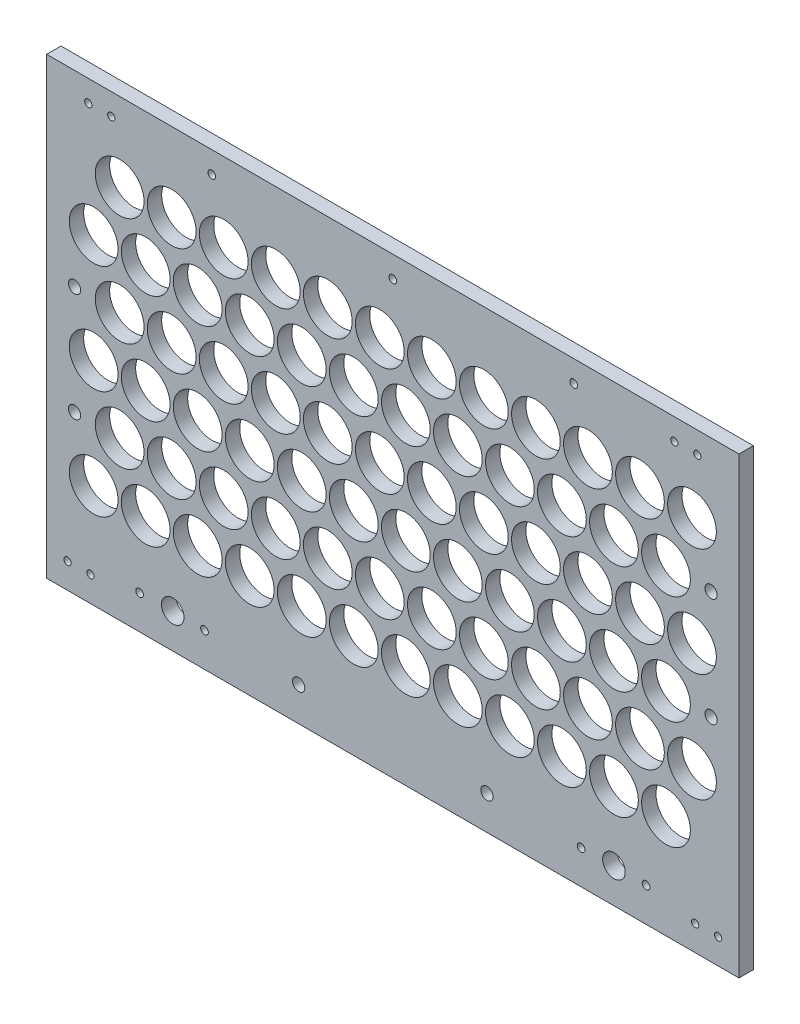
from build123d import *

# Parameters (mm, degrees)
SKETCH1_W                  = 306.05000007
SKETCH1_H                  = 197.4250001
BOSS_EXTRUDE1_DEPTH        = 6.35
SKETCH3_R                  = 10.775
CUT_EXTRUDE1_DEPTH         = 187.132543615
SKETCH4_R                  = 10.775
CUT_EXTRUDE2_DEPTH         = 187.132543615
LPATTERN1_COUNT            = 12
LPATTERN1_PITCH            = 23
LPATTERN2_COUNT            = 3
LPATTERN2_PITCH            = 48
LPATTERN2_COPY_1_SKETCH_R  = 10.775
LPATTERN2_COPY_1_DEPTH     = 187.132543615
LPATTERN2_COPY_2_SKETCH_R  = 10.775
LPATTERN2_COPY_2_DEPTH     = 187.132543615
LPATTERN2_COPY_3_SKETCH_R  = 10.775
LPATTERN2_COPY_3_DEPTH     = 187.132543615
LPATTERN2_COPY_4_SKETCH_R  = 10.775
LPATTERN2_COPY_4_DEPTH     = 187.132543615
LPATTERN2_COPY_5_SKETCH_R  = 10.775
LPATTERN2_COPY_5_DEPTH     = 187.132543615
LPATTERN2_COPY_6_SKETCH_R  = 10.775
LPATTERN2_COPY_6_DEPTH     = 187.132543615
LPATTERN2_COPY_7_SKETCH_R  = 10.775
LPATTERN2_COPY_7_DEPTH     = 187.132543615
LPATTERN2_COPY_8_SKETCH_R  = 10.775
LPATTERN2_COPY_8_DEPTH     = 187.132543615
LPATTERN2_COPY_9_SKETCH_R  = 10.775
LPATTERN2_COPY_9_DEPTH     = 187.132543615
LPATTERN2_COPY_10_SKETCH_R = 10.775
LPATTERN2_COPY_10_DEPTH    = 187.132543615
LPATTERN2_COPY_11_SKETCH_R = 10.775
LPATTERN2_COPY_11_DEPTH    = 187.132543615
LPATTERN2_COPY_12_SKETCH_R = 10.775
LPATTERN2_COPY_12_DEPTH    = 187.132543615
LPATTERN2_COPY_13_SKETCH_R = 10.775
LPATTERN2_COPY_13_DEPTH    = 187.132543615
LPATTERN2_COPY_14_SKETCH_R = 10.775
LPATTERN2_COPY_14_DEPTH    = 187.132543615
LPATTERN2_COPY_15_SKETCH_R = 10.775
LPATTERN2_COPY_15_DEPTH    = 187.132543615
LPATTERN2_COPY_16_SKETCH_R = 10.775
LPATTERN2_COPY_16_DEPTH    = 187.132543615
LPATTERN2_COPY_17_SKETCH_R = 10.775
LPATTERN2_COPY_17_DEPTH    = 187.132543615
LPATTERN2_COPY_18_SKETCH_R = 10.775
LPATTERN2_COPY_18_DEPTH    = 187.132543615
LPATTERN2_COPY_19_SKETCH_R = 10.775
LPATTERN2_COPY_19_DEPTH    = 187.132543615
LPATTERN2_COPY_20_SKETCH_R = 10.775
LPATTERN2_COPY_20_DEPTH    = 187.132543615
LPATTERN2_COPY_21_SKETCH_R = 10.775
LPATTERN2_COPY_21_DEPTH    = 187.132543615
LPATTERN2_COPY_22_SKETCH_R = 10.775
LPATTERN2_COPY_22_DEPTH    = 187.132543615
LPATTERN2_COPY_23_SKETCH_R = 10.775
LPATTERN2_COPY_23_DEPTH    = 187.132543615
LPATTERN2_COPY_24_SKETCH_R = 10.775
LPATTERN2_COPY_24_DEPTH    = 187.132543615
LPATTERN2_COPY_25_SKETCH_R = 10.775
LPATTERN2_COPY_25_DEPTH    = 187.132543615
LPATTERN2_COPY_26_SKETCH_R = 10.775
LPATTERN2_COPY_26_DEPTH    = 187.132543615
LPATTERN2_COPY_27_SKETCH_R = 10.775
LPATTERN2_COPY_27_DEPTH    = 187.132543615
LPATTERN2_COPY_28_SKETCH_R = 10.775
LPATTERN2_COPY_28_DEPTH    = 187.132543615
LPATTERN2_COPY_29_SKETCH_R = 10.775
LPATTERN2_COPY_29_DEPTH    = 187.132543615
LPATTERN2_COPY_30_SKETCH_R = 10.775
LPATTERN2_COPY_30_DEPTH    = 187.132543615
LPATTERN2_COPY_31_SKETCH_R = 10.775
LPATTERN2_COPY_31_DEPTH    = 187.132543615
LPATTERN2_COPY_32_SKETCH_R = 10.775
LPATTERN2_COPY_32_DEPTH    = 187.132543615
LPATTERN2_COPY_33_SKETCH_R = 10.775
LPATTERN2_COPY_33_DEPTH    = 187.132543615
LPATTERN2_COPY_34_SKETCH_R = 10.775
LPATTERN2_COPY_34_DEPTH    = 187.132543615
LPATTERN2_COPY_35_SKETCH_R = 10.775
LPATTERN2_COPY_35_DEPTH    = 187.132543615
LPATTERN2_COPY_36_SKETCH_R = 10.775
LPATTERN2_COPY_36_DEPTH    = 187.132543615
LPATTERN2_COPY_37_SKETCH_R = 10.775
LPATTERN2_COPY_37_DEPTH    = 187.132543615
LPATTERN2_COPY_38_SKETCH_R = 10.775
LPATTERN2_COPY_38_DEPTH    = 187.132543615
LPATTERN2_COPY_39_SKETCH_R = 10.775
LPATTERN2_COPY_39_DEPTH    = 187.132543615
LPATTERN2_COPY_40_SKETCH_R = 10.775
LPATTERN2_COPY_40_DEPTH    = 187.132543615
LPATTERN2_COPY_41_SKETCH_R = 10.775
LPATTERN2_COPY_41_DEPTH    = 187.132543615
LPATTERN2_COPY_42_SKETCH_R = 10.775
LPATTERN2_COPY_42_DEPTH    = 187.132543615
LPATTERN2_COPY_43_SKETCH_R = 10.775
LPATTERN2_COPY_43_DEPTH    = 187.132543615
LPATTERN2_COPY_44_SKETCH_R = 10.775
LPATTERN2_COPY_44_DEPTH    = 187.132543615
SKETCH5_R                  = 5
CUT_EXTRUDE3_DEPTH         = 187.132543615
M3_CLEARANCE_HOLE1_D       = 3.4
M3_CLEARANCE_HOLE2_D       = 3.2
SKETCH12_R                 = 2.7
CUT_EXTRUDE4_DEPTH         = 187.132543615
SKETCH13_W                 = 306.05000007
SKETCH13_H                 = 6.35
BOSS_EXTRUDE2_DEPTH        = 3.175


with BuildPart() as part:
    # Sketch1 → Boss-Extrude1 (new body)
    with BuildSketch(Plane.XY):
        with Locations((3.5e-08, -7.06250005)):
            Rectangle(SKETCH1_W, SKETCH1_H)
    extrude(amount=BOSS_EXTRUDE1_DEPTH)

    # Sketch3 → Cut-Extrude1 (cut, through all)
    with BuildSketch(Plane.XY.offset(6.35)):
        with Locations((-132.25, -60)):
            Circle(SKETCH3_R)
    cut_extrude1 = extrude(amount=-CUT_EXTRUDE1_DEPTH, mode=Mode.SUBTRACT)

    # Sketch4 → Cut-Extrude2 (cut, through all)
    with BuildSketch(Plane.XY.offset(6.35)):
        with Locations((-120.75, -36)):
            Circle(SKETCH4_R)
    cut_extrude2 = extrude(amount=-CUT_EXTRUDE2_DEPTH, mode=Mode.SUBTRACT)

    # LPattern1: Cut-Extrude1, Cut-Extrude2 ×12
    with Locations(*[(i * LPATTERN1_PITCH, 0, 0) for i in range(1, LPATTERN1_COUNT)]):
        add(cut_extrude1, mode=Mode.SUBTRACT)
        add(cut_extrude2, mode=Mode.SUBTRACT)

    # LPattern2: Cut-Extrude1, Cut-Extrude2 ×3
    with Locations(*[(0, i * LPATTERN2_PITCH, 0) for i in range(1, LPATTERN2_COUNT)]):
        add(cut_extrude1, mode=Mode.SUBTRACT)
        add(cut_extrude2, mode=Mode.SUBTRACT)

    # LPattern2 copy 1 sketch → LPattern2 copy 1 (cut, through all)
    with BuildSketch(Plane(origin=(23, 48, 6.35), x_dir=(1, 0, 0), z_dir=(0, 0, 1))):
        with Locations((-132.25, -60)):
            Circle(LPATTERN2_COPY_1_SKETCH_R)
    extrude(amount=-LPATTERN2_COPY_1_DEPTH, mode=Mode.SUBTRACT)

    # LPattern2 copy 2 sketch → LPattern2 copy 2 (cut, through all)
    with BuildSketch(Plane(origin=(23, 96, 6.35), x_dir=(1, 0, 0), z_dir=(0, 0, 1))):
        with Locations((-132.25, -60)):
            Circle(LPATTERN2_COPY_2_SKETCH_R)
    extrude(amount=-LPATTERN2_COPY_2_DEPTH, mode=Mode.SUBTRACT)

    # LPattern2 copy 3 sketch → LPattern2 copy 3 (cut, through all)
    with BuildSketch(Plane(origin=(46, 48, 6.35), x_dir=(1, 0, 0), z_dir=(0, 0, 1))):
        with Locations((-132.25, -60)):
            Circle(LPATTERN2_COPY_3_SKETCH_R)
    extrude(amount=-LPATTERN2_COPY_3_DEPTH, mode=Mode.SUBTRACT)

    # LPattern2 copy 4 sketch → LPattern2 copy 4 (cut, through all)
    with BuildSketch(Plane(origin=(46, 96, 6.35), x_dir=(1, 0, 0), z_dir=(0, 0, 1))):
        with Locations((-132.25, -60)):
            Circle(LPATTERN2_COPY_4_SKETCH_R)
    extrude(amount=-LPATTERN2_COPY_4_DEPTH, mode=Mode.SUBTRACT)

    # LPattern2 copy 5 sketch → LPattern2 copy 5 (cut, through all)
    with BuildSketch(Plane(origin=(69, 48, 6.35), x_dir=(1, 0, 0), z_dir=(0, 0, 1))):
        with Locations((-132.25, -60)):
            Circle(LPATTERN2_COPY_5_SKETCH_R)
    extrude(amount=-LPATTERN2_COPY_5_DEPTH, mode=Mode.SUBTRACT)

    # LPattern2 copy 6 sketch → LPattern2 copy 6 (cut, through all)
    with BuildSketch(Plane(origin=(69, 96, 6.35), x_dir=(1, 0, 0), z_dir=(0, 0, 1))):
        with Locations((-132.25, -60)):
            Circle(LPATTERN2_COPY_6_SKETCH_R)
    extrude(amount=-LPATTERN2_COPY_6_DEPTH, mode=Mode.SUBTRACT)

    # LPattern2 copy 7 sketch → LPattern2 copy 7 (cut, through all)
    with BuildSketch(Plane(origin=(92, 48, 6.35), x_dir=(1, 0, 0), z_dir=(0, 0, 1))):
        with Locations((-132.25, -60)):
            Circle(LPATTERN2_COPY_7_SKETCH_R)
    extrude(amount=-LPATTERN2_COPY_7_DEPTH, mode=Mode.SUBTRACT)

    # LPattern2 copy 8 sketch → LPattern2 copy 8 (cut, through all)
    with BuildSketch(Plane(origin=(92, 96, 6.35), x_dir=(1, 0, 0), z_dir=(0, 0, 1))):
        with Locations((-132.25, -60)):
            Circle(LPATTERN2_COPY_8_SKETCH_R)
    extrude(amount=-LPATTERN2_COPY_8_DEPTH, mode=Mode.SUBTRACT)

    # LPattern2 copy 9 sketch → LPattern2 copy 9 (cut, through all)
    with BuildSketch(Plane(origin=(115, 48, 6.35), x_dir=(1, 0, 0), z_dir=(0, 0, 1))):
        with Locations((-132.25, -60)):
            Circle(LPATTERN2_COPY_9_SKETCH_R)
    extrude(amount=-LPATTERN2_COPY_9_DEPTH, mode=Mode.SUBTRACT)

    # LPattern2 copy 10 sketch → LPattern2 copy 10 (cut, through all)
    with BuildSketch(Plane(origin=(115, 96, 6.35), x_dir=(1, 0, 0), z_dir=(0, 0, 1))):
        with Locations((-132.25, -60)):
            Circle(LPATTERN2_COPY_10_SKETCH_R)
    extrude(amount=-LPATTERN2_COPY_10_DEPTH, mode=Mode.SUBTRACT)

    # LPattern2 copy 11 sketch → LPattern2 copy 11 (cut, through all)
    with BuildSketch(Plane(origin=(138, 48, 6.35), x_dir=(1, 0, 0), z_dir=(0, 0, 1))):
        with Locations((-132.25, -60)):
            Circle(LPATTERN2_COPY_11_SKETCH_R)
    extrude(amount=-LPATTERN2_COPY_11_DEPTH, mode=Mode.SUBTRACT)

    # LPattern2 copy 12 sketch → LPattern2 copy 12 (cut, through all)
    with BuildSketch(Plane(origin=(138, 96, 6.35), x_dir=(1, 0, 0), z_dir=(0, 0, 1))):
        with Locations((-132.25, -60)):
            Circle(LPATTERN2_COPY_12_SKETCH_R)
    extrude(amount=-LPATTERN2_COPY_12_DEPTH, mode=Mode.SUBTRACT)

    # LPattern2 copy 13 sketch → LPattern2 copy 13 (cut, through all)
    with BuildSketch(Plane(origin=(161, 48, 6.35), x_dir=(1, 0, 0), z_dir=(0, 0, 1))):
        with Locations((-132.25, -60)):
            Circle(LPATTERN2_COPY_13_SKETCH_R)
    extrude(amount=-LPATTERN2_COPY_13_DEPTH, mode=Mode.SUBTRACT)

    # LPattern2 copy 14 sketch → LPattern2 copy 14 (cut, through all)
    with BuildSketch(Plane(origin=(161, 96, 6.35), x_dir=(1, 0, 0), z_dir=(0, 0, 1))):
        with Locations((-132.25, -60)):
            Circle(LPATTERN2_COPY_14_SKETCH_R)
    extrude(amount=-LPATTERN2_COPY_14_DEPTH, mode=Mode.SUBTRACT)

    # LPattern2 copy 15 sketch → LPattern2 copy 15 (cut, through all)
    with BuildSketch(Plane(origin=(184, 48, 6.35), x_dir=(1, 0, 0), z_dir=(0, 0, 1))):
        with Locations((-132.25, -60)):
            Circle(LPATTERN2_COPY_15_SKETCH_R)
    extrude(amount=-LPATTERN2_COPY_15_DEPTH, mode=Mode.SUBTRACT)

    # LPattern2 copy 16 sketch → LPattern2 copy 16 (cut, through all)
    with BuildSketch(Plane(origin=(184, 96, 6.35), x_dir=(1, 0, 0), z_dir=(0, 0, 1))):
        with Locations((-132.25, -60)):
            Circle(LPATTERN2_COPY_16_SKETCH_R)
    extrude(amount=-LPATTERN2_COPY_16_DEPTH, mode=Mode.SUBTRACT)

    # LPattern2 copy 17 sketch → LPattern2 copy 17 (cut, through all)
    with BuildSketch(Plane(origin=(207, 48, 6.35), x_dir=(1, 0, 0), z_dir=(0, 0, 1))):
        with Locations((-132.25, -60)):
            Circle(LPATTERN2_COPY_17_SKETCH_R)
    extrude(amount=-LPATTERN2_COPY_17_DEPTH, mode=Mode.SUBTRACT)

    # LPattern2 copy 18 sketch → LPattern2 copy 18 (cut, through all)
    with BuildSketch(Plane(origin=(207, 96, 6.35), x_dir=(1, 0, 0), z_dir=(0, 0, 1))):
        with Locations((-132.25, -60)):
            Circle(LPATTERN2_COPY_18_SKETCH_R)
    extrude(amount=-LPATTERN2_COPY_18_DEPTH, mode=Mode.SUBTRACT)

    # LPattern2 copy 19 sketch → LPattern2 copy 19 (cut, through all)
    with BuildSketch(Plane(origin=(230, 48, 6.35), x_dir=(1, 0, 0), z_dir=(0, 0, 1))):
        with Locations((-132.25, -60)):
            Circle(LPATTERN2_COPY_19_SKETCH_R)
    extrude(amount=-LPATTERN2_COPY_19_DEPTH, mode=Mode.SUBTRACT)

    # LPattern2 copy 20 sketch → LPattern2 copy 20 (cut, through all)
    with BuildSketch(Plane(origin=(230, 96, 6.35), x_dir=(1, 0, 0), z_dir=(0, 0, 1))):
        with Locations((-132.25, -60)):
            Circle(LPATTERN2_COPY_20_SKETCH_R)
    extrude(amount=-LPATTERN2_COPY_20_DEPTH, mode=Mode.SUBTRACT)

    # LPattern2 copy 21 sketch → LPattern2 copy 21 (cut, through all)
    with BuildSketch(Plane(origin=(253, 48, 6.35), x_dir=(1, 0, 0), z_dir=(0, 0, 1))):
        with Locations((-132.25, -60)):
            Circle(LPATTERN2_COPY_21_SKETCH_R)
    extrude(amount=-LPATTERN2_COPY_21_DEPTH, mode=Mode.SUBTRACT)

    # LPattern2 copy 22 sketch → LPattern2 copy 22 (cut, through all)
    with BuildSketch(Plane(origin=(253, 96, 6.35), x_dir=(1, 0, 0), z_dir=(0, 0, 1))):
        with Locations((-132.25, -60)):
            Circle(LPATTERN2_COPY_22_SKETCH_R)
    extrude(amount=-LPATTERN2_COPY_22_DEPTH, mode=Mode.SUBTRACT)

    # LPattern2 copy 23 sketch → LPattern2 copy 23 (cut, through all)
    with BuildSketch(Plane(origin=(23, 48, 6.35), x_dir=(1, 0, 0), z_dir=(0, 0, 1))):
        with Locations((-120.75, -36)):
            Circle(LPATTERN2_COPY_23_SKETCH_R)
    extrude(amount=-LPATTERN2_COPY_23_DEPTH, mode=Mode.SUBTRACT)

    # LPattern2 copy 24 sketch → LPattern2 copy 24 (cut, through all)
    with BuildSketch(Plane(origin=(23, 96, 6.35), x_dir=(1, 0, 0), z_dir=(0, 0, 1))):
        with Locations((-120.75, -36)):
            Circle(LPATTERN2_COPY_24_SKETCH_R)
    extrude(amount=-LPATTERN2_COPY_24_DEPTH, mode=Mode.SUBTRACT)

    # LPattern2 copy 25 sketch → LPattern2 copy 25 (cut, through all)
    with BuildSketch(Plane(origin=(46, 48, 6.35), x_dir=(1, 0, 0), z_dir=(0, 0, 1))):
        with Locations((-120.75, -36)):
            Circle(LPATTERN2_COPY_25_SKETCH_R)
    extrude(amount=-LPATTERN2_COPY_25_DEPTH, mode=Mode.SUBTRACT)

    # LPattern2 copy 26 sketch → LPattern2 copy 26 (cut, through all)
    with BuildSketch(Plane(origin=(46, 96, 6.35), x_dir=(1, 0, 0), z_dir=(0, 0, 1))):
        with Locations((-120.75, -36)):
            Circle(LPATTERN2_COPY_26_SKETCH_R)
    extrude(amount=-LPATTERN2_COPY_26_DEPTH, mode=Mode.SUBTRACT)

    # LPattern2 copy 27 sketch → LPattern2 copy 27 (cut, through all)
    with BuildSketch(Plane(origin=(69, 48, 6.35), x_dir=(1, 0, 0), z_dir=(0, 0, 1))):
        with Locations((-120.75, -36)):
            Circle(LPATTERN2_COPY_27_SKETCH_R)
    extrude(amount=-LPATTERN2_COPY_27_DEPTH, mode=Mode.SUBTRACT)

    # LPattern2 copy 28 sketch → LPattern2 copy 28 (cut, through all)
    with BuildSketch(Plane(origin=(69, 96, 6.35), x_dir=(1, 0, 0), z_dir=(0, 0, 1))):
        with Locations((-120.75, -36)):
            Circle(LPATTERN2_COPY_28_SKETCH_R)
    extrude(amount=-LPATTERN2_COPY_28_DEPTH, mode=Mode.SUBTRACT)

    # LPattern2 copy 29 sketch → LPattern2 copy 29 (cut, through all)
    with BuildSketch(Plane(origin=(92, 48, 6.35), x_dir=(1, 0, 0), z_dir=(0, 0, 1))):
        with Locations((-120.75, -36)):
            Circle(LPATTERN2_COPY_29_SKETCH_R)
    extrude(amount=-LPATTERN2_COPY_29_DEPTH, mode=Mode.SUBTRACT)

    # LPattern2 copy 30 sketch → LPattern2 copy 30 (cut, through all)
    with BuildSketch(Plane(origin=(92, 96, 6.35), x_dir=(1, 0, 0), z_dir=(0, 0, 1))):
        with Locations((-120.75, -36)):
            Circle(LPATTERN2_COPY_30_SKETCH_R)
    extrude(amount=-LPATTERN2_COPY_30_DEPTH, mode=Mode.SUBTRACT)

    # LPattern2 copy 31 sketch → LPattern2 copy 31 (cut, through all)
    with BuildSketch(Plane(origin=(115, 48, 6.35), x_dir=(1, 0, 0), z_dir=(0, 0, 1))):
        with Locations((-120.75, -36)):
            Circle(LPATTERN2_COPY_31_SKETCH_R)
    extrude(amount=-LPATTERN2_COPY_31_DEPTH, mode=Mode.SUBTRACT)

    # LPattern2 copy 32 sketch → LPattern2 copy 32 (cut, through all)
    with BuildSketch(Plane(origin=(115, 96, 6.35), x_dir=(1, 0, 0), z_dir=(0, 0, 1))):
        with Locations((-120.75, -36)):
            Circle(LPATTERN2_COPY_32_SKETCH_R)
    extrude(amount=-LPATTERN2_COPY_32_DEPTH, mode=Mode.SUBTRACT)

    # LPattern2 copy 33 sketch → LPattern2 copy 33 (cut, through all)
    with BuildSketch(Plane(origin=(138, 48, 6.35), x_dir=(1, 0, 0), z_dir=(0, 0, 1))):
        with Locations((-120.75, -36)):
            Circle(LPATTERN2_COPY_33_SKETCH_R)
    extrude(amount=-LPATTERN2_COPY_33_DEPTH, mode=Mode.SUBTRACT)

    # LPattern2 copy 34 sketch → LPattern2 copy 34 (cut, through all)
    with BuildSketch(Plane(origin=(138, 96, 6.35), x_dir=(1, 0, 0), z_dir=(0, 0, 1))):
        with Locations((-120.75, -36)):
            Circle(LPATTERN2_COPY_34_SKETCH_R)
    extrude(amount=-LPATTERN2_COPY_34_DEPTH, mode=Mode.SUBTRACT)

    # LPattern2 copy 35 sketch → LPattern2 copy 35 (cut, through all)
    with BuildSketch(Plane(origin=(161, 48, 6.35), x_dir=(1, 0, 0), z_dir=(0, 0, 1))):
        with Locations((-120.75, -36)):
            Circle(LPATTERN2_COPY_35_SKETCH_R)
    extrude(amount=-LPATTERN2_COPY_35_DEPTH, mode=Mode.SUBTRACT)

    # LPattern2 copy 36 sketch → LPattern2 copy 36 (cut, through all)
    with BuildSketch(Plane(origin=(161, 96, 6.35), x_dir=(1, 0, 0), z_dir=(0, 0, 1))):
        with Locations((-120.75, -36)):
            Circle(LPATTERN2_COPY_36_SKETCH_R)
    extrude(amount=-LPATTERN2_COPY_36_DEPTH, mode=Mode.SUBTRACT)

    # LPattern2 copy 37 sketch → LPattern2 copy 37 (cut, through all)
    with BuildSketch(Plane(origin=(184, 48, 6.35), x_dir=(1, 0, 0), z_dir=(0, 0, 1))):
        with Locations((-120.75, -36)):
            Circle(LPATTERN2_COPY_37_SKETCH_R)
    extrude(amount=-LPATTERN2_COPY_37_DEPTH, mode=Mode.SUBTRACT)

    # LPattern2 copy 38 sketch → LPattern2 copy 38 (cut, through all)
    with BuildSketch(Plane(origin=(184, 96, 6.35), x_dir=(1, 0, 0), z_dir=(0, 0, 1))):
        with Locations((-120.75, -36)):
            Circle(LPATTERN2_COPY_38_SKETCH_R)
    extrude(amount=-LPATTERN2_COPY_38_DEPTH, mode=Mode.SUBTRACT)

    # LPattern2 copy 39 sketch → LPattern2 copy 39 (cut, through all)
    with BuildSketch(Plane(origin=(207, 48, 6.35), x_dir=(1, 0, 0), z_dir=(0, 0, 1))):
        with Locations((-120.75, -36)):
            Circle(LPATTERN2_COPY_39_SKETCH_R)
    extrude(amount=-LPATTERN2_COPY_39_DEPTH, mode=Mode.SUBTRACT)

    # LPattern2 copy 40 sketch → LPattern2 copy 40 (cut, through all)
    with BuildSketch(Plane(origin=(207, 96, 6.35), x_dir=(1, 0, 0), z_dir=(0, 0, 1))):
        with Locations((-120.75, -36)):
            Circle(LPATTERN2_COPY_40_SKETCH_R)
    extrude(amount=-LPATTERN2_COPY_40_DEPTH, mode=Mode.SUBTRACT)

    # LPattern2 copy 41 sketch → LPattern2 copy 41 (cut, through all)
    with BuildSketch(Plane(origin=(230, 48, 6.35), x_dir=(1, 0, 0), z_dir=(0, 0, 1))):
        with Locations((-120.75, -36)):
            Circle(LPATTERN2_COPY_41_SKETCH_R)
    extrude(amount=-LPATTERN2_COPY_41_DEPTH, mode=Mode.SUBTRACT)

    # LPattern2 copy 42 sketch → LPattern2 copy 42 (cut, through all)
    with BuildSketch(Plane(origin=(230, 96, 6.35), x_dir=(1, 0, 0), z_dir=(0, 0, 1))):
        with Locations((-120.75, -36)):
            Circle(LPATTERN2_COPY_42_SKETCH_R)
    extrude(amount=-LPATTERN2_COPY_42_DEPTH, mode=Mode.SUBTRACT)

    # LPattern2 copy 43 sketch → LPattern2 copy 43 (cut, through all)
    with BuildSketch(Plane(origin=(253, 48, 6.35), x_dir=(1, 0, 0), z_dir=(0, 0, 1))):
        with Locations((-120.75, -36)):
            Circle(LPATTERN2_COPY_43_SKETCH_R)
    extrude(amount=-LPATTERN2_COPY_43_DEPTH, mode=Mode.SUBTRACT)

    # LPattern2 copy 44 sketch → LPattern2 copy 44 (cut, through all)
    with BuildSketch(Plane(origin=(253, 96, 6.35), x_dir=(1, 0, 0), z_dir=(0, 0, 1))):
        with Locations((-120.75, -36)):
            Circle(LPATTERN2_COPY_44_SKETCH_R)
    extrude(amount=-LPATTERN2_COPY_44_DEPTH, mode=Mode.SUBTRACT)

    # Sketch5 → Cut-Extrude3 (cut, through all)
    with BuildSketch(Plane(origin=(0, 0, 0), x_dir=(-1, 0, 0), z_dir=(0, 0, -1))):
        with Locations((-97.75, -90.3965)):
            Circle(SKETCH5_R)
        with Locations((97.288, -90.3965)):
            Circle(SKETCH5_R)
    extrude(amount=-CUT_EXTRUDE3_DEPTH, mode=Mode.SUBTRACT)

    # M3 Clearance Hole1 (through all)
    with Locations(Plane(origin=(0, 0, 0), x_dir=(-1, 0, 0), z_dir=(0, 0, -1))):
        with Locations((-111.94, -90.775), (80, 85.3), (0, 85.3), (-80, 85.3), (-83.25, -90.775), (111.94, -90.775), (83.25, -90.775)):
            Hole(M3_CLEARANCE_HOLE1_D / 2)

    # M3 Clearance Hole2 (through all)
    with Locations(Plane(origin=(0, 0, 0), x_dir=(-1, 0, 0), z_dir=(0, 0, -1))):
        with Locations((-143.817500066, -94.6000001), (-133.657500066, -94.6000001), (-134.610000066, 85.3), (-124.450000066, 85.3), (124.450000066, 85.3), (134.610000066, 85.3), (133.657500066, -94.6000001), (143.817500066, -94.6000001)):
            Hole(M3_CLEARANCE_HOLE2_D / 2)

    # Sketch12 → Cut-Extrude4 (cut, through all)
    with BuildSketch(Plane(origin=(0, 0, 0), x_dir=(-1, 0, 0), z_dir=(0, 0, -1))):
        with Locations((41.625, -90.775)):
            Circle(SKETCH12_R)
        with Locations(Location((-41.625, -90.775, 0), (0, 0, 180))):
            Circle(SKETCH12_R)
        with Locations((140.687500033, -36)):
            Circle(SKETCH12_R)
        with Locations((-140.687500033, 36)):
            Circle(SKETCH12_R)
        with Locations((140.687500033, 12)):
            Circle(SKETCH12_R)
        with Locations((-140.687500033, -12)):
            Circle(SKETCH12_R)
    extrude(amount=-CUT_EXTRUDE4_DEPTH, mode=Mode.SUBTRACT)

    # Sketch13 → Boss-Extrude2 (add)
    with BuildSketch(Plane(origin=(0, 91.65, 0), x_dir=(1, 0, 0), z_dir=(0, 1, 0))):
        with Locations((3.5e-08, -3.175)):
            Rectangle(SKETCH13_W, SKETCH13_H)
    extrude(amount=BOSS_EXTRUDE2_DEPTH)


solid = part.part
